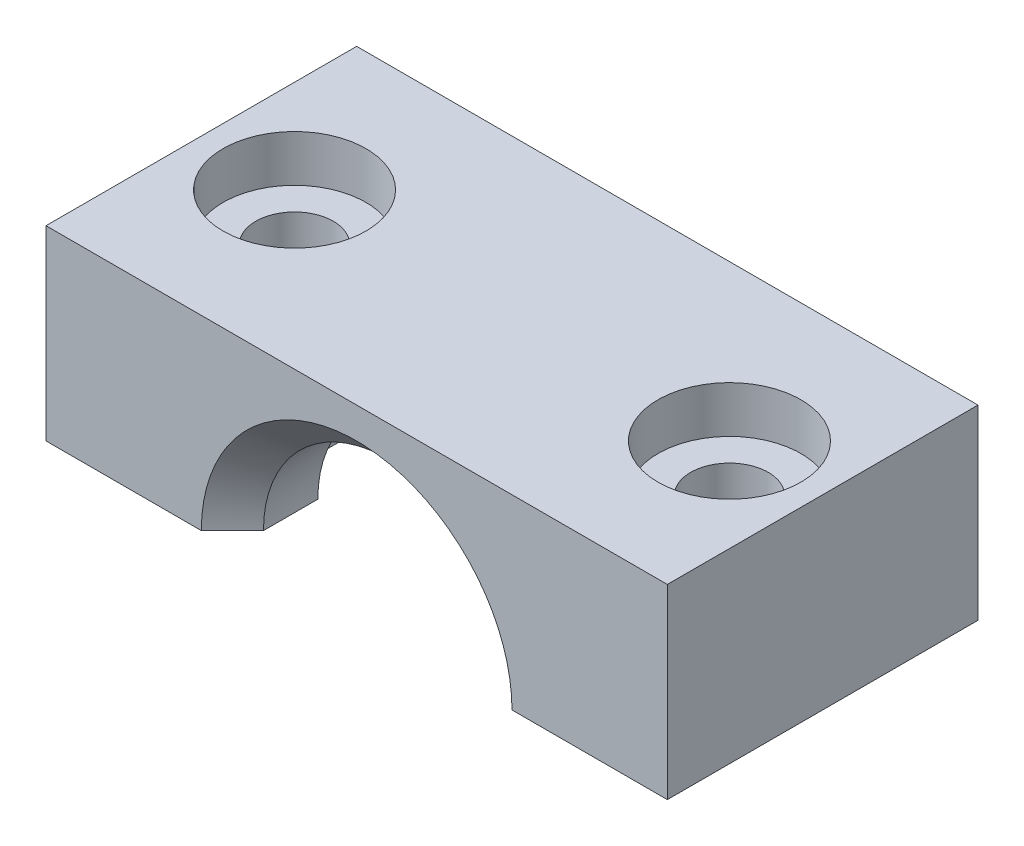
from build123d import *

# Parameters (mm, degrees)
SKETCH_2_W             = 20
SKETCH_2_H             = 6
EXTRUDE_379_DEPTH      = 5
SKETCH_3_R             = 4
CUT_EXTRUDE_526_DEPTH  = 16.362291496
SKETCH_4_R             = 5.25
CUT_EXTRUDE_602_DEPTH  = 2.25
SKETCH_5_R             = 1.25
CUT_EXTRUDE_755_DEPTH  = 13.68857754
CHAMFER_2_SIZE         = 1
SKETCH_6_R             = 2.3
CUT_EXTRUDE_1018_DEPTH = 1.5


with BuildPart() as part:
    # Эскиз2 → Extrude 379 (new, symmetric)
    with BuildSketch(Plane.XY):
        with Locations((0, 3)):
            Rectangle(SKETCH_2_W, SKETCH_2_H)
    extrude(amount=EXTRUDE_379_DEPTH, both=True)

    # Эскиз3 → Cut-Extrude 526 (cut, through all)
    with BuildSketch(Plane.XY.offset(5)):
        Circle(SKETCH_3_R)
    extrude(amount=-CUT_EXTRUDE_526_DEPTH, mode=Mode.SUBTRACT)

    # Эскиз4 → Cut-Extrude 602 (cut, symmetric)
    with BuildSketch(Plane.XY):
        Circle(SKETCH_4_R)
    extrude(amount=CUT_EXTRUDE_602_DEPTH, both=True, mode=Mode.SUBTRACT)

    # Эскиз5 → Cut-Extrude 755 (cut, through all)
    with BuildSketch(Plane(origin=(0, 6, 0), x_dir=(1, 0, 0), z_dir=(0, 1, 0))):
        with Locations(Location((-7, 0, 0), (0, 0, 270))):
            Circle(SKETCH_5_R)
        with Locations(Location((7, 0, 0), (0, 0, 270))):
            Circle(SKETCH_5_R)
    extrude(amount=-CUT_EXTRUDE_755_DEPTH, mode=Mode.SUBTRACT)

    # Фаска2
    chamfer_2_edges = [part.edges().sort_by_distance(p)[0] for p in [
        (0, 4, 5),
        (0, 4, -5),
    ]]
    chamfer(chamfer_2_edges, length=CHAMFER_2_SIZE)

    # Эскиз6 → Cut-Extrude 1018 (cut)
    with BuildSketch(Plane(origin=(0, 6, 0), x_dir=(1, 0, 0), z_dir=(0, 1, 0))):
        with Locations(Location((-7, 0, 0), (0, 0, 270))):
            Circle(SKETCH_6_R)
        with Locations(Location((7, 0, 0), (0, 0, 270))):
            Circle(SKETCH_6_R)
    extrude(amount=-CUT_EXTRUDE_1018_DEPTH, mode=Mode.SUBTRACT)


solid = part.part
